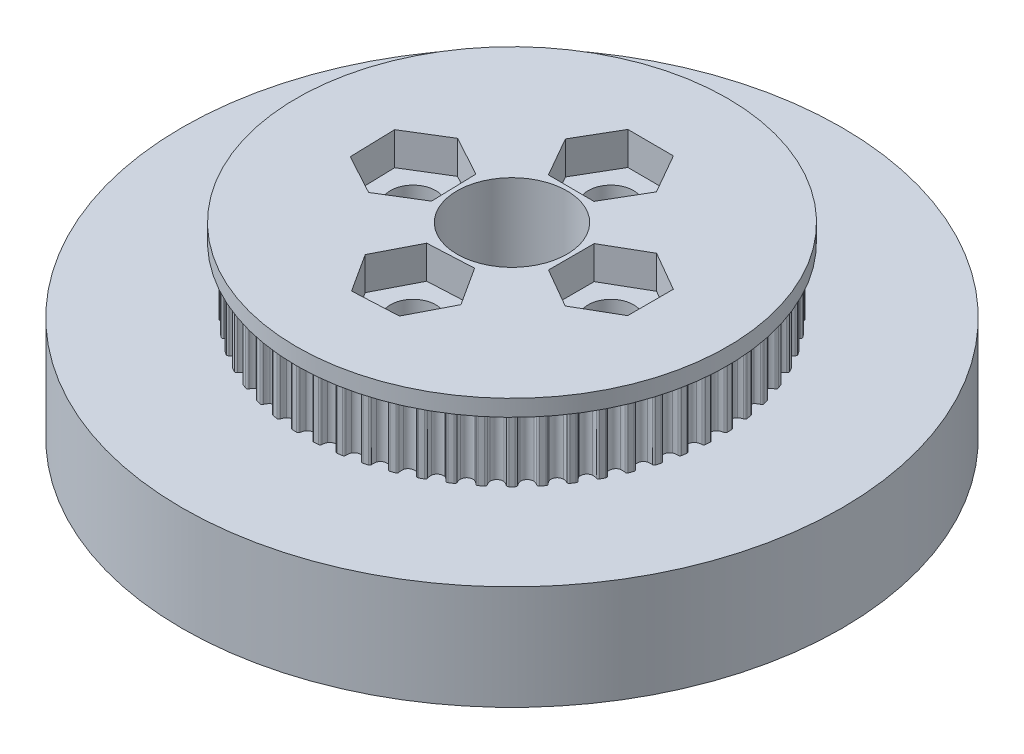
from build123d import *

# Parameters (mm, degrees)
SKETCH1_R                = 18.844609303
BOSS_EXTRUDE1_DEPTH      = 6
CUT_EXTRUDE1_START       = -10
CUT_EXTRUDE1_DEPTH       = 10
FILLET1_R                = 0.17
CIRPATTERN2_COUNT        = 60
FILLET1_OF_CIRPATTERN2_R = 0.17
SKETCH3_R                = 19.594609303
BOSS_EXTRUDE2_DEPTH      = 1.5
SKETCH4_R                = 30
BOSS_EXTRUDE3_DEPTH      = 9.5
SKETCH5_R                = 24.5
CUT_EXTRUDE2_DEPTH       = 4
SKETCH6_R                = 17
BOSS_EXTRUDE4_DEPTH      = 2
SKETCH7_R                = 12.5
BOSS_EXTRUDE5_DEPTH      = 11.5
SKETCH8_R                = 2.05
CUT_EXTRUDE3_DEPTH       = 51.02249506
CUT_EXTRUDE4_DEPTH       = 3
SKETCH10_R               = 5
CUT_EXTRUDE5_DEPTH       = 51.02249506


with BuildPart() as part:
    # Sketch1 → Boss-Extrude1 (new body)
    with BuildSketch(Plane(origin=(0, 0, 0), x_dir=(1, 0, 0), z_dir=(0, 1, 0))):
        Circle(SKETCH1_R)
    extrude(amount=BOSS_EXTRUDE1_DEPTH)

    # Sketch2 → Cut-Extrude1 (cut)
    with BuildSketch(Plane(origin=(0, 6, 0), x_dir=(1, 0, 0), z_dir=(0, 1, 0)).offset(CUT_EXTRUDE1_START)):
        with BuildLine():
            ThreePointArc((0.453553699, 18.286177496), (0.576034086, 18.548370442), (0.619948996, 18.834409017))
            ThreePointArc((0.619948996, 18.834409017), (0, 18.844609303), (-0.619948996, 18.834409017))
            ThreePointArc((-0.619948996, 18.834409017), (-0.576034086, 18.548370442), (-0.453553699, 18.286177496))
            ThreePointArc((-0.453553699, 18.286177496), (0, 18.064609303), (0.453553699, 18.286177496))
        make_face()
    cut_extrude1 = extrude(amount=CUT_EXTRUDE1_DEPTH, mode=Mode.SUBTRACT)

    # Fillet1
    fillet1_edges = [part.edges().sort_by_distance(p)[0] for p in [
        (0.619948996, 3, -18.834409017),
        (-0.619948996, 3, -18.834409017),
    ]]
    fillet(fillet1_edges, radius=FILLET1_R)

    # CirPattern2: Cut-Extrude1 ×60 about axis
    cirpattern2_axis = Axis((0, 6, 0), (0, -1, 0))
    for i in range(1, CIRPATTERN2_COUNT):
        add(cut_extrude1.rotate(cirpattern2_axis, i * 360 / CIRPATTERN2_COUNT), mode=Mode.SUBTRACT)

    # Fillet1 of CirPattern2
    fillet1_of_cirpattern2_edges = [part.edges().sort_by_distance(p)[0] for p in [
        (2.585284682, 3, -18.666429838),
        (1.352178981, 3, -18.79603447),
        (4.522295447, 3, -18.293937347),
        (3.309492201, 3, -18.551726635),
        (6.409758998, 3, -17.721012651),
        (5.230545933, 3, -18.104162202),
        (8.226995887, 3, -16.953932831),
        (7.094292709, 3, -17.458244778),
        (9.954096088, 3, -16.001102176),
        (8.880312929, 3, -16.621051172),
        (11.572137129, 3, -14.872960097),
        (10.569038583, 3, -15.601753851),
        (13.063391414, 3, -13.581866754),
        (12.141967638, 3, -14.411520449),
        (14.411520449, 3, -12.141967638),
        (13.581866754, 3, -13.063391414),
        (15.601753851, 3, -10.569038583),
        (14.872960097, 3, -11.572137129),
        (16.621051172, 3, -8.880312929),
        (16.001102176, 3, -9.954096088),
        (17.458244778, 3, -7.094292709),
        (16.953932831, 3, -8.226995887),
        (18.104162202, 3, -5.230545933),
        (17.721012651, 3, -6.409758998),
        (18.551726635, 3, -3.309492201),
        (18.293937347, 3, -4.522295447),
        (18.79603447, 3, -1.352178981),
        (18.666429838, 3, -2.585284682),
        (18.834409017, 3, 0.619948996),
        (18.834409017, 3, -0.619948996),
        (18.666429838, 3, 2.585284682),
        (18.79603447, 3, 1.352178981),
        (18.293937347, 3, 4.522295447),
        (18.551726635, 3, 3.309492201),
        (17.721012651, 3, 6.409758998),
        (18.104162202, 3, 5.230545933),
        (16.953932831, 3, 8.226995887),
        (17.458244778, 3, 7.094292709),
        (16.001102176, 3, 9.954096088),
        (16.621051172, 3, 8.880312929),
        (14.872960097, 3, 11.572137129),
        (15.601753851, 3, 10.569038583),
        (13.581866754, 3, 13.063391414),
        (14.411520449, 3, 12.141967638),
        (12.141967638, 3, 14.411520449),
        (13.063391414, 3, 13.581866754),
        (10.569038583, 3, 15.601753851),
        (11.572137129, 3, 14.872960097),
        (8.880312929, 3, 16.621051172),
        (9.954096088, 3, 16.001102176),
        (7.094292709, 3, 17.458244778),
        (8.226995887, 3, 16.953932831),
        (5.230545933, 3, 18.104162202),
        (6.409758998, 3, 17.721012651),
        (3.309492201, 3, 18.551726635),
        (4.522295447, 3, 18.293937347),
        (1.352178981, 3, 18.79603447),
        (2.585284682, 3, 18.666429838),
        (-0.619948996, 3, 18.834409017),
        (0.619948996, 3, 18.834409017),
        (-2.585284682, 3, 18.666429838),
        (-1.352178981, 3, 18.79603447),
        (-4.522295447, 3, 18.293937347),
        (-3.309492201, 3, 18.551726635),
        (-6.409758998, 3, 17.721012651),
        (-5.230545933, 3, 18.104162202),
        (-8.226995887, 3, 16.953932831),
        (-7.094292709, 3, 17.458244778),
        (-9.954096088, 3, 16.001102176),
        (-8.880312929, 3, 16.621051172),
        (-11.572137129, 3, 14.872960097),
        (-10.569038583, 3, 15.601753851),
        (-13.063391414, 3, 13.581866754),
        (-12.141967638, 3, 14.411520449),
        (-14.411520449, 3, 12.141967638),
        (-13.581866754, 3, 13.063391414),
        (-15.601753851, 3, 10.569038583),
        (-14.872960097, 3, 11.572137129),
        (-16.621051172, 3, 8.880312929),
        (-16.001102176, 3, 9.954096088),
        (-17.458244778, 3, 7.094292709),
        (-16.953932831, 3, 8.226995887),
        (-18.104162202, 3, 5.230545933),
        (-17.721012651, 3, 6.409758998),
        (-18.551726635, 3, 3.309492201),
        (-18.293937347, 3, 4.522295447),
        (-18.79603447, 3, 1.352178981),
        (-18.666429838, 3, 2.585284682),
        (-18.834409017, 3, -0.619948996),
        (-18.834409017, 3, 0.619948996),
        (-18.666429838, 3, -2.585284682),
        (-18.79603447, 3, -1.352178981),
        (-18.293937347, 3, -4.522295447),
        (-18.551726635, 3, -3.309492201),
        (-17.721012651, 3, -6.409758998),
        (-18.104162202, 3, -5.230545933),
        (-16.953932831, 3, -8.226995887),
        (-17.458244778, 3, -7.094292709),
        (-16.001102176, 3, -9.954096088),
        (-16.621051172, 3, -8.880312929),
        (-14.872960097, 3, -11.572137129),
        (-15.601753851, 3, -10.569038583),
        (-13.581866754, 3, -13.063391414),
        (-14.411520449, 3, -12.141967638),
        (-12.141967638, 3, -14.411520449),
        (-13.063391414, 3, -13.581866754),
        (-10.569038583, 3, -15.601753851),
        (-11.572137129, 3, -14.872960097),
        (-8.880312929, 3, -16.621051172),
        (-9.954096088, 3, -16.001102176),
        (-7.094292709, 3, -17.458244778),
        (-8.226995887, 3, -16.953932831),
        (-5.230545933, 3, -18.104162202),
        (-6.409758998, 3, -17.721012651),
        (-3.309492201, 3, -18.551726635),
        (-4.522295447, 3, -18.293937347),
        (-1.352178981, 3, -18.79603447),
        (-2.585284682, 3, -18.666429838),
    ]]
    fillet(fillet1_of_cirpattern2_edges, radius=FILLET1_OF_CIRPATTERN2_R)

    # Sketch3 → Boss-Extrude2 (add)
    with BuildSketch(Plane(origin=(0, 6, 0), x_dir=(1, 0, 0), z_dir=(0, 1, 0))):
        Circle(SKETCH3_R)
    extrude(amount=BOSS_EXTRUDE2_DEPTH)

    # Sketch4 → Boss-Extrude3 (add)
    with BuildSketch(Plane.XZ):
        Circle(SKETCH4_R)
    extrude(amount=BOSS_EXTRUDE3_DEPTH)

    # Sketch5 → Cut-Extrude2 (cut)
    with BuildSketch(Plane.XZ.offset(9.5)):
        Circle(SKETCH5_R)
    extrude(amount=-CUT_EXTRUDE2_DEPTH, mode=Mode.SUBTRACT)

    # Sketch6 → Boss-Extrude4 (add)
    with BuildSketch(Plane.XZ.offset(5.5)):
        Circle(SKETCH6_R)
    extrude(amount=BOSS_EXTRUDE4_DEPTH)

    # Sketch7 → Boss-Extrude5 (add)
    with BuildSketch(Plane.XZ.offset(7.5)):
        Circle(SKETCH7_R)
    extrude(amount=BOSS_EXTRUDE5_DEPTH)

    # Sketch8 → Cut-Extrude3 (cut, through all)
    with BuildSketch(Plane.XZ.offset(19)):
        with Locations((0, 9)):
            Circle(SKETCH8_R)
        with Locations((9, 0)):
            Circle(SKETCH8_R)
        with Locations((0, -9)):
            Circle(SKETCH8_R)
        with Locations((-9, 0)):
            Circle(SKETCH8_R)
    extrude(amount=-CUT_EXTRUDE3_DEPTH, mode=Mode.SUBTRACT)

    # Sketch9 → Cut-Extrude4 (cut)
    with BuildSketch(Plane(origin=(0, 7.5, 0), x_dir=(1, 0, 0), z_dir=(0, 1, 0))):
        Polygon((-4.151817058, -9.205949306), (-1.897551198, -12.698553697), (2.25426586, -12.492604391), (4.151817058, -8.794050694), (1.897551198, -5.301446303), (-2.25426586, -5.507395609), align=None)
        Polygon((-9.111424966, 4.155428315), (-12.654418967, 1.981217306), (-12.542994001, -2.174211008), (-8.888575034, -4.155428315), (-5.345581033, -1.981217306), (-5.457005999, 2.174211008), align=None)
        Polygon((-2.063394687, 12.608656587), (-4.156885622, 9.017376077), (-2.093490935, 5.408719489), (2.063394687, 5.391343413), (4.156885622, 8.982623923), (2.093490935, 12.591280511), align=None)
        Polygon((9, 4.156921938), (5.4, 2.078460969), (5.4, -2.078460969), (9, -4.156921938), (12.6, -2.078460969), (12.6, 2.078460969), align=None)
    extrude(amount=-CUT_EXTRUDE4_DEPTH, mode=Mode.SUBTRACT)

    # Sketch10 → Cut-Extrude5 (cut, through all)
    with BuildSketch(Plane(origin=(0, 7.5, 0), x_dir=(1, 0, 0), z_dir=(0, 1, 0))):
        Circle(SKETCH10_R)
    extrude(amount=-CUT_EXTRUDE5_DEPTH, mode=Mode.SUBTRACT)


solid = part.part
